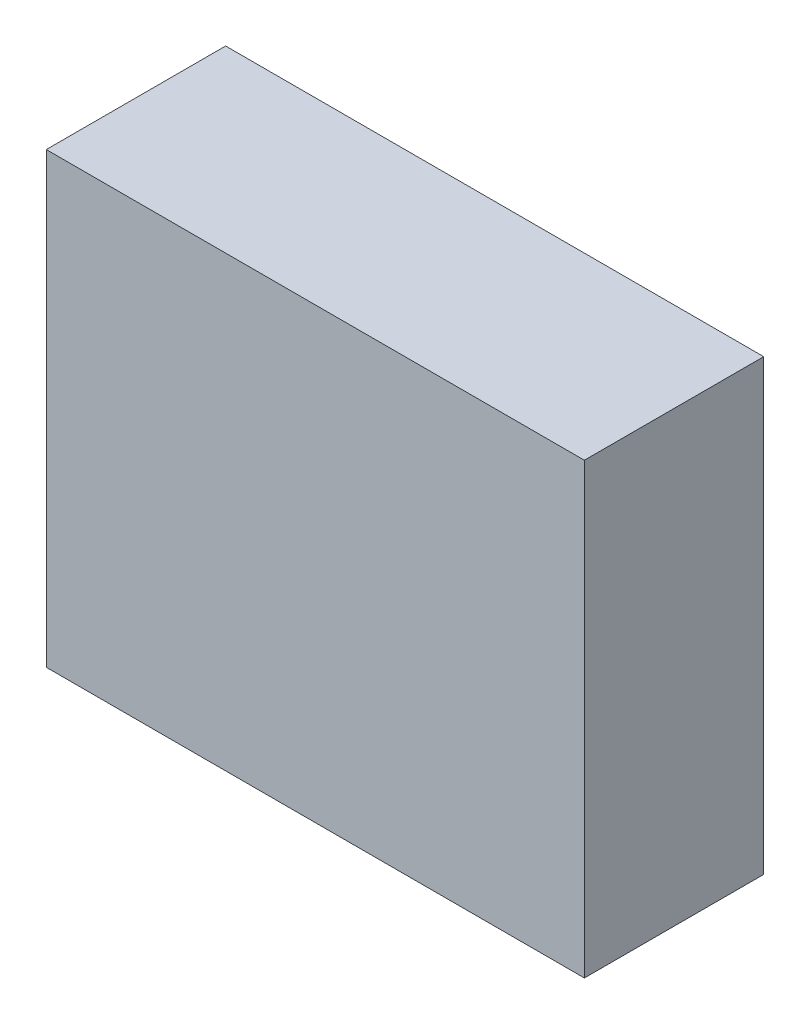
from build123d import *

# Parameters (mm, degrees)
ESQUISSE1_W        = 30
ESQUISSE1_H        = 25
BOSS_EXTRU_1_DEPTH = 10


with BuildPart() as part:
    # Esquisse1 → Boss.-Extru.1 (new body)
    with BuildSketch(Plane.XY):
        Rectangle(ESQUISSE1_W, ESQUISSE1_H)
    extrude(amount=BOSS_EXTRU_1_DEPTH)


solid = part.part
